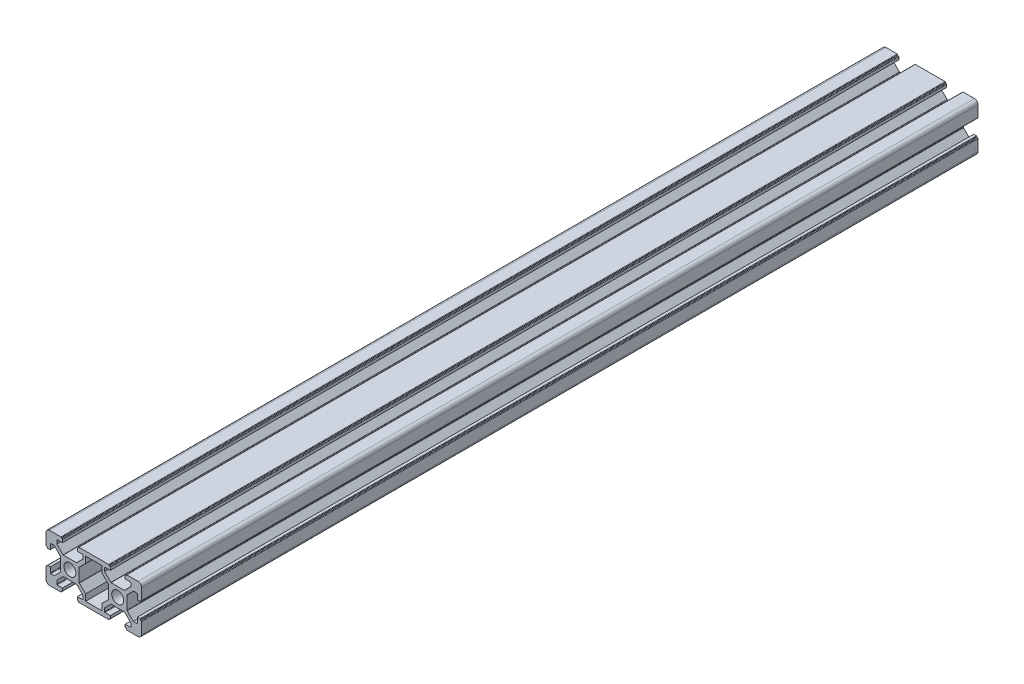
from build123d import *

# Parameters (mm, degrees)
BOSS_EXTRUDE1_DEPTH = 350
SKETCH2_R           = 2.5
CUT_EXTRUDE1_DEPTH  = 352.425667816


with BuildPart() as part:
    # Sketch1 → Boss-Extrude1 (new body)
    with BuildSketch(Plane.XY):
        with BuildLine():
            Line((-8.5, 10), (-3.8, 10))
            ThreePointArc((-3.8, 10), (-3.658578644, 9.941421356), (-3.6, 9.8))
            Line((-3.6, 9.8), (-3.6, 9.7))
            ThreePointArc((-3.6, 9.7), (-3.541421356, 9.558578644), (-3.4, 9.5))
            Line((-3.4, 9.5), (-3.3, 9.5))
            ThreePointArc((-3.3, 9.5), (-3.158578644, 9.441421356), (-3.1, 9.3))
            Line((-3.1, 9.3), (-3.1, 8.2))
            Line((-3.1, 8.2), (-5.3, 8.2))
            ThreePointArc((-5.3, 8.2), (-5.441421356, 8.141421356), (-5.5, 8))
            Line((-5.5, 8), (-5.5, 6.560660172))
            Line((-5.5, 6.560660172), (-2.897918472, 3.958578644))
            ThreePointArc((-2.897918472, 3.958578644), (-2.833033802, 3.915224093), (-2.756497116, 3.9))
            Line((-2.756497116, 3.9), (2.756497116, 3.9))
            ThreePointArc((2.756497116, 3.9), (2.833033802, 3.915224093), (2.897918472, 3.958578644))
            Line((2.897918472, 3.958578644), (5.5, 6.560660172))
            Line((5.5, 6.560660172), (5.5, 8))
            ThreePointArc((5.5, 8), (5.441421356, 8.141421356), (5.3, 8.2))
            Line((5.3, 8.2), (3.1, 8.2))
            Line((3.1, 8.2), (3.1, 9.3))
            ThreePointArc((3.1, 9.3), (3.158578644, 9.441421356), (3.3, 9.5))
            Line((3.3, 9.5), (3.4, 9.5))
            ThreePointArc((3.4, 9.5), (3.541421356, 9.558578644), (3.6, 9.7))
            Line((3.6, 9.7), (3.6, 9.8))
            ThreePointArc((3.6, 9.8), (3.658578644, 9.941421356), (3.8, 10))
            Line((3.8, 10), (8.5, 10))
            Line((8.5, 10), (11.5, 10))
            Line((11.5, 10), (16.2, 10))
            ThreePointArc((16.2, 10), (16.341421356, 9.941421356), (16.4, 9.8))
            Line((16.4, 9.8), (16.4, 9.7))
            ThreePointArc((16.4, 9.7), (16.458578644, 9.558578644), (16.6, 9.5))
            Line((16.6, 9.5), (16.7, 9.5))
            ThreePointArc((16.7, 9.5), (16.841421356, 9.441421356), (16.9, 9.3))
            Line((16.9, 9.3), (16.9, 8.2))
            Line((16.9, 8.2), (14.7, 8.2))
            ThreePointArc((14.7, 8.2), (14.558578644, 8.141421356), (14.5, 8))
            Line((14.5, 8), (14.5, 6.560660172))
            Line((14.5, 6.560660172), (17.102081528, 3.958578644))
            ThreePointArc((17.102081528, 3.958578644), (17.166966198, 3.915224093), (17.243502884, 3.9))
            Line((17.243502884, 3.9), (22.756497116, 3.9))
            ThreePointArc((22.756497116, 3.9), (22.833033802, 3.915224093), (22.897918472, 3.958578644))
            Line((22.897918472, 3.958578644), (25.5, 6.560660172))
            Line((25.5, 6.560660172), (25.5, 8))
            ThreePointArc((25.5, 8), (25.441421356, 8.141421356), (25.3, 8.2))
            Line((25.3, 8.2), (23.1, 8.2))
            Line((23.1, 8.2), (23.1, 9.3))
            ThreePointArc((23.1, 9.3), (23.158578644, 9.441421356), (23.3, 9.5))
            Line((23.3, 9.5), (23.4, 9.5))
            ThreePointArc((23.4, 9.5), (23.541421356, 9.558578644), (23.6, 9.7))
            Line((23.6, 9.7), (23.6, 9.8))
            ThreePointArc((23.6, 9.8), (23.658578644, 9.941421356), (23.8, 10))
            Line((23.8, 10), (28.5, 10))
            ThreePointArc((28.5, 10), (29.560660172, 9.560660172), (30, 8.5))
            Line((30, 8.5), (30, 3.8))
            ThreePointArc((30, 3.8), (29.941421356, 3.658578644), (29.8, 3.6))
            Line((29.8, 3.6), (29.7, 3.6))
            ThreePointArc((29.7, 3.6), (29.558578644, 3.541421356), (29.5, 3.4))
            Line((29.5, 3.4), (29.5, 3.3))
            ThreePointArc((29.5, 3.3), (29.441421356, 3.158578644), (29.3, 3.1))
            Line((29.3, 3.1), (28.2, 3.1))
            Line((28.2, 3.1), (28.2, 5.3))
            ThreePointArc((28.2, 5.3), (28.141421356, 5.441421356), (28, 5.5))
            Line((28, 5.5), (26.560660172, 5.5))
            Line((26.560660172, 5.5), (23.958578644, 2.897918472))
            ThreePointArc((23.958578644, 2.897918472), (23.915224093, 2.833033802), (23.9, 2.756497116))
            Line((23.9, 2.756497116), (23.9, -2.756497116))
            ThreePointArc((23.9, -2.756497116), (23.915224093, -2.833033802), (23.958578644, -2.897918472))
            Line((23.958578644, -2.897918472), (26.560660172, -5.5))
            Line((26.560660172, -5.5), (28, -5.5))
            ThreePointArc((28, -5.5), (28.141421356, -5.441421356), (28.2, -5.3))
            Line((28.2, -5.3), (28.2, -3.1))
            Line((28.2, -3.1), (29.3, -3.1))
            ThreePointArc((29.3, -3.1), (29.441421356, -3.158578644), (29.5, -3.3))
            Line((29.5, -3.3), (29.5, -3.4))
            ThreePointArc((29.5, -3.4), (29.558578644, -3.541421356), (29.7, -3.6))
            Line((29.7, -3.6), (29.8, -3.6))
            ThreePointArc((29.8, -3.6), (29.941421356, -3.658578644), (30, -3.8))
            Line((30, -3.8), (30, -8.5))
            ThreePointArc((30, -8.5), (29.560660172, -9.560660172), (28.5, -10))
            Line((28.5, -10), (23.8, -10))
            ThreePointArc((23.8, -10), (23.658578644, -9.941421356), (23.6, -9.8))
            Line((23.6, -9.8), (23.6, -9.7))
            ThreePointArc((23.6, -9.7), (23.541421356, -9.558578644), (23.4, -9.5))
            Line((23.4, -9.5), (23.3, -9.5))
            ThreePointArc((23.3, -9.5), (23.158578644, -9.441421356), (23.1, -9.3))
            Line((23.1, -9.3), (23.1, -8.2))
            Line((23.1, -8.2), (25.3, -8.2))
            ThreePointArc((25.3, -8.2), (25.441421356, -8.141421356), (25.5, -8))
            Line((25.5, -8), (25.5, -6.560660172))
            Line((25.5, -6.560660172), (22.897918472, -3.958578644))
            ThreePointArc((22.897918472, -3.958578644), (22.833033802, -3.915224093), (22.756497116, -3.9))
            Line((22.756497116, -3.9), (17.243502884, -3.9))
            ThreePointArc((17.243502884, -3.9), (17.166966198, -3.915224093), (17.102081528, -3.958578644))
            Line((17.102081528, -3.958578644), (14.5, -6.560660172))
            Line((14.5, -6.560660172), (14.5, -8))
            ThreePointArc((14.5, -8), (14.558578644, -8.141421356), (14.7, -8.2))
            Line((14.7, -8.2), (16.9, -8.2))
            Line((16.9, -8.2), (16.9, -9.3))
            ThreePointArc((16.9, -9.3), (16.841421356, -9.441421356), (16.7, -9.5))
            Line((16.7, -9.5), (16.6, -9.5))
            ThreePointArc((16.6, -9.5), (16.458578644, -9.558578644), (16.4, -9.7))
            Line((16.4, -9.7), (16.4, -9.8))
            ThreePointArc((16.4, -9.8), (16.341421356, -9.941421356), (16.2, -10))
            Line((16.2, -10), (11.5, -10))
            Line((11.5, -10), (8.5, -10))
            Line((8.5, -10), (3.8, -10))
            ThreePointArc((3.8, -10), (3.658578644, -9.941421356), (3.6, -9.8))
            Line((3.6, -9.8), (3.6, -9.7))
            ThreePointArc((3.6, -9.7), (3.541421356, -9.558578644), (3.4, -9.5))
            Line((3.4, -9.5), (3.3, -9.5))
            ThreePointArc((3.3, -9.5), (3.158578644, -9.441421356), (3.1, -9.3))
            Line((3.1, -9.3), (3.1, -8.2))
            Line((3.1, -8.2), (5.3, -8.2))
            ThreePointArc((5.3, -8.2), (5.441421356, -8.141421356), (5.5, -8))
            Line((5.5, -8), (5.5, -6.560660172))
            Line((5.5, -6.560660172), (2.897918472, -3.958578644))
            ThreePointArc((2.897918472, -3.958578644), (2.833033802, -3.915224093), (2.756497116, -3.9))
            Line((2.756497116, -3.9), (-2.756497116, -3.9))
            ThreePointArc((-2.756497116, -3.9), (-2.833033802, -3.915224093), (-2.897918472, -3.958578644))
            Line((-2.897918472, -3.958578644), (-5.5, -6.560660172))
            Line((-5.5, -6.560660172), (-5.5, -8))
            ThreePointArc((-5.5, -8), (-5.441421356, -8.141421356), (-5.3, -8.2))
            Line((-5.3, -8.2), (-3.1, -8.2))
            Line((-3.1, -8.2), (-3.1, -9.3))
            ThreePointArc((-3.1, -9.3), (-3.158578644, -9.441421356), (-3.3, -9.5))
            Line((-3.3, -9.5), (-3.4, -9.5))
            ThreePointArc((-3.4, -9.5), (-3.541421356, -9.558578644), (-3.6, -9.7))
            Line((-3.6, -9.7), (-3.6, -9.8))
            ThreePointArc((-3.6, -9.8), (-3.658578644, -9.941421356), (-3.8, -10))
            Line((-3.8, -10), (-8.5, -10))
            ThreePointArc((-8.5, -10), (-9.560660172, -9.560660172), (-10, -8.5))
            Line((-10, -8.5), (-10, -3.8))
            ThreePointArc((-10, -3.8), (-9.941421356, -3.658578644), (-9.8, -3.6))
            Line((-9.8, -3.6), (-9.7, -3.6))
            ThreePointArc((-9.7, -3.6), (-9.558578644, -3.541421356), (-9.5, -3.4))
            Line((-9.5, -3.4), (-9.5, -3.3))
            ThreePointArc((-9.5, -3.3), (-9.441421356, -3.158578644), (-9.3, -3.1))
            Line((-9.3, -3.1), (-8.2, -3.1))
            Line((-8.2, -3.1), (-8.2, -5.3))
            ThreePointArc((-8.2, -5.3), (-8.141421356, -5.441421356), (-8, -5.5))
            Line((-8, -5.5), (-6.560660172, -5.5))
            Line((-6.560660172, -5.5), (-3.958578644, -2.897918472))
            ThreePointArc((-3.958578644, -2.897918472), (-3.915224093, -2.833033802), (-3.9, -2.756497116))
            Line((-3.9, -2.756497116), (-3.9, 2.756497116))
            ThreePointArc((-3.9, 2.756497116), (-3.915224093, 2.833033802), (-3.958578644, 2.897918472))
            Line((-3.958578644, 2.897918472), (-6.560660172, 5.5))
            Line((-6.560660172, 5.5), (-8, 5.5))
            ThreePointArc((-8, 5.5), (-8.141421356, 5.441421356), (-8.2, 5.3))
            Line((-8.2, 5.3), (-8.2, 3.1))
            Line((-8.2, 3.1), (-9.3, 3.1))
            ThreePointArc((-9.3, 3.1), (-9.441421356, 3.158578644), (-9.5, 3.3))
            Line((-9.5, 3.3), (-9.5, 3.4))
            ThreePointArc((-9.5, 3.4), (-9.558578644, 3.541421356), (-9.7, 3.6))
            Line((-9.7, 3.6), (-9.8, 3.6))
            ThreePointArc((-9.8, 3.6), (-9.941421356, 3.658578644), (-10, 3.8))
            Line((-10, 3.8), (-10, 8.5))
            ThreePointArc((-10, 8.5), (-9.560660172, 9.560660172), (-8.5, 10))
        make_face()
        with BuildLine():
            Line((3.9, 2.756497116), (3.9, -2.756497116))
            ThreePointArc((3.9, -2.756497116), (3.915224093, -2.833033802), (3.958578644, -2.897918472))
            Line((3.958578644, -2.897918472), (6.560660172, -5.5))
            Line((6.560660172, -5.5), (6.560660172, -8.2))
            Line((6.560660172, -8.2), (13.439339828, -8.2))
            Line((13.439339828, -8.2), (13.439339828, -5.5))
            Line((13.439339828, -5.5), (16.041421356, -2.897918472))
            ThreePointArc((16.041421356, -2.897918472), (16.084775907, -2.833033802), (16.1, -2.756497116))
            Line((16.1, -2.756497116), (16.1, 2.756497116))
            ThreePointArc((16.1, 2.756497116), (16.084775907, 2.833033802), (16.041421356, 2.897918472))
            Line((16.041421356, 2.897918472), (13.439339828, 5.5))
            Line((13.439339828, 5.5), (13.439339828, 8.2))
            Line((13.439339828, 8.2), (6.560660172, 8.2))
            Line((6.560660172, 8.2), (6.560660172, 5.5))
            Line((6.560660172, 5.5), (3.958578644, 2.897918472))
            ThreePointArc((3.958578644, 2.897918472), (3.915224093, 2.833033802), (3.9, 2.756497116))
        make_face(mode=Mode.SUBTRACT)
    extrude(amount=BOSS_EXTRUDE1_DEPTH)

    # Sketch2 → Cut-Extrude1 (cut, through all)
    with BuildSketch(Plane.XY.offset(350)):
        Circle(SKETCH2_R)
        with Locations(Location((20, 0, 0), (0, 0, 180))):
            Circle(SKETCH2_R)
    extrude(amount=-CUT_EXTRUDE1_DEPTH, mode=Mode.SUBTRACT)


solid = part.part
